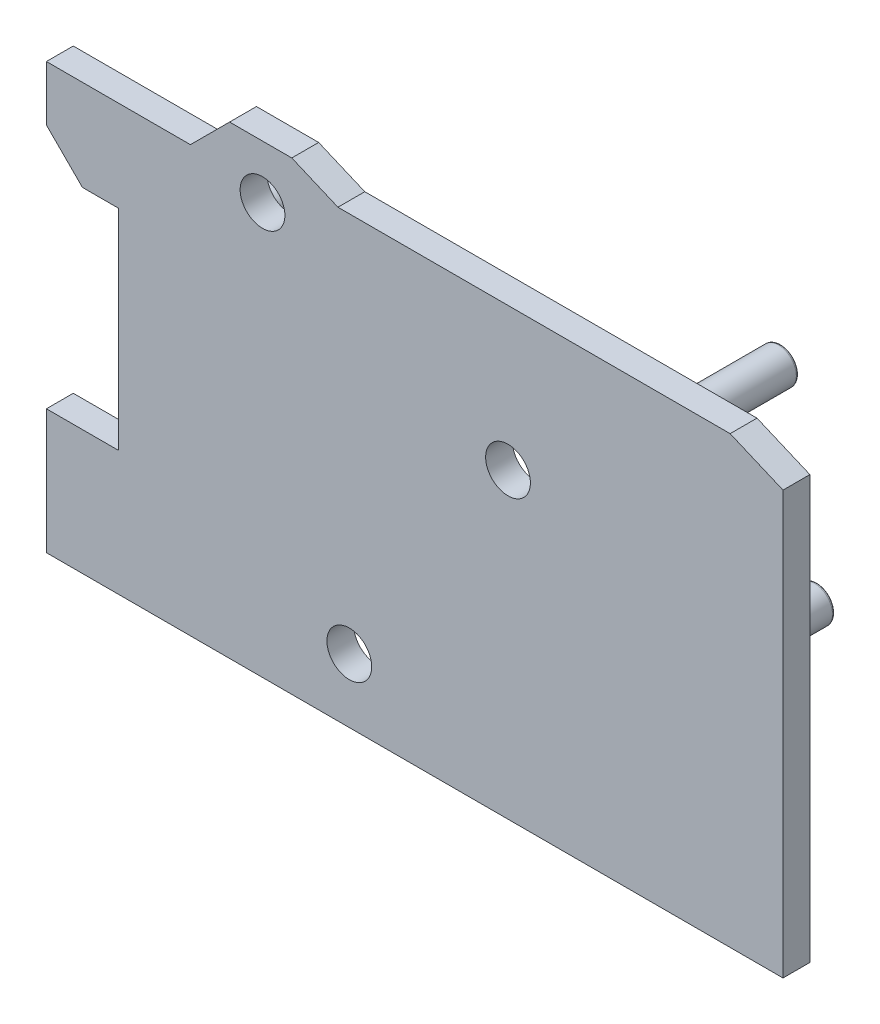
from build123d import *

# Parameters (mm, degrees)
SKETCH_2_R       = 2.5
EXTRUDE_11_DEPTH = 3
SKETCH_2_16_R    = 2
SKETCH_2_16_R_2  = 4
EXTRUDE_12_DEPTH = 0.5
SKETCH_2_17_R    = 2
EXTRUDE_13_DEPTH = 12.5
FILLET_1_R       = 0.3


with BuildPart() as part:
    # 스케치2 → 보스-돌출11 (new body)
    with BuildSketch(Plane.XY):
        Polygon((-25.900833035, 21.467672234), (-41.985987982, 21.467672234), (-41.985987982, 15.322651266), (-37.964699246, 11.301362529), (-33.943410509, 11.301362529), (-33.943410509, -12.123358681), (-41.985987982, -12.123358681), (-41.985987982, -26.048068749), (40.290588771, -26.048068749), (40.290588771, 21.148605879), (34.384238258, 23.655411353), (-9.421808725, 23.655411353), (-14.576398582, 25.843150472), (-21.525354797, 25.843150472), align=None)
        with Locations((-8.153758739, -18.910029411)):
            Circle(SKETCH_2_R, mode=Mode.SUBTRACT)
        with Locations((-17.847699606, 19.897540861)):
            Circle(SKETCH_2_R, mode=Mode.SUBTRACT)
        with Locations((9.574246485, 7.73050044)):
            Circle(SKETCH_2_R, mode=Mode.SUBTRACT)
    extrude(amount=EXTRUDE_11_DEPTH)

    # 스케치2<16> → 보스-돌출12 (add)
    # profile 1 of 3: a face of its own
    with BuildSketch(Plane.XY):
        with BuildLine():
            ThreePointArc((23.706105599, -5.125632338), (23.939439675, -5.923767386), (24.695702599, -6.26949956))
            Line((24.695702599, -6.26949956), (30.574246485, -6.26949956))
            ThreePointArc((30.574246485, -6.26949956), (31.281353266, -5.976606341), (31.574246485, -5.26949956))
            Line((31.574246485, -5.26949956), (31.574246485, 0.609044326))
            ThreePointArc((31.574246485, 0.609044326), (31.228514311, 1.365307251), (30.430379263, 1.598641326))
            ThreePointArc((30.430379263, 1.598641326), (25.952143977, -0.647397052), (23.706105599, -5.125632338))
        make_face()
        with Locations((28.616748621, -3.312001696)):
            Circle(SKETCH_2_16_R, mode=Mode.SUBTRACT)
    # profile 2 of 3: a face of its own
    with BuildSketch(Plane.XY):
        with Locations((-29.162107176, 7.874269984)):
            Circle(SKETCH_2_16_R_2)
        with Locations((-29.162107176, 7.874269984)):
            Circle(SKETCH_2_16_R, mode=Mode.SUBTRACT)
    # profile 3 of 3: a face of its own
    with BuildSketch(Plane.XY):
        with Locations((24.574246485, 17.73050044)):
            Circle(SKETCH_2_16_R_2)
        with Locations((24.574246485, 17.73050044)):
            Circle(SKETCH_2_16_R, mode=Mode.SUBTRACT)
    extrude(amount=-EXTRUDE_12_DEPTH)

    # 스케치2<17> → 보스-돌출13 (add)
    with BuildSketch(Plane.XY):
        with Locations((-29.162107176, 7.874269984)):
            Circle(SKETCH_2_17_R)
        with Locations((24.574246485, 17.73050044)):
            Circle(SKETCH_2_17_R)
        with Locations((28.616748621, -3.312001696)):
            Circle(SKETCH_2_17_R)
    extrude(amount=-EXTRUDE_13_DEPTH)

    # 필렛1
    fillet_1_edges = [part.edges().sort_by_distance(p)[0] for p in [
        (26.616748621, -3.312001696, -12.5),
        (22.574246485, 17.73050044, -12.5),
        (-31.162107176, 7.874269984, -12.5),
    ]]
    fillet(fillet_1_edges, radius=FILLET_1_R)


solid = part.part
